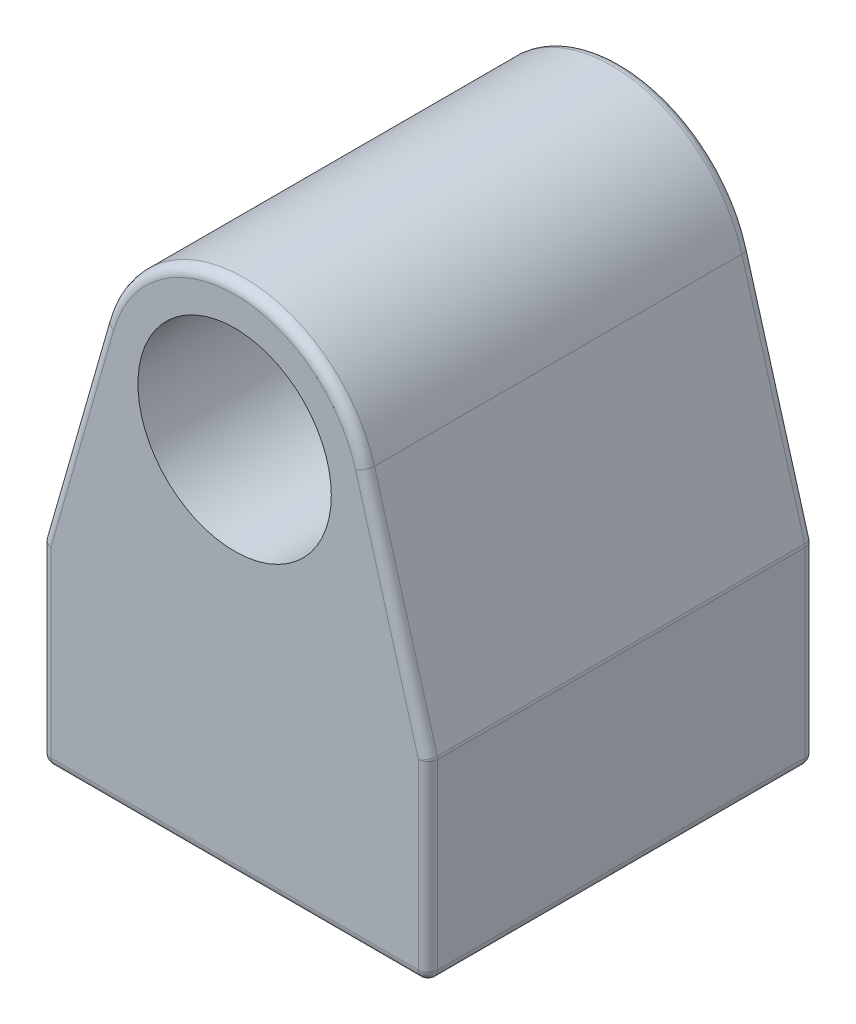
from build123d import *

# Parameters (mm, degrees)
SKETCH_1_R      = 5
EXTRUDE_1_DEPTH = 20
FILLET_1_R      = 0.5


with BuildPart() as part:
    # 草图1 → 凸台-拉伸1 (new body)
    with BuildSketch(Plane.XY):
        with BuildLine():
            Line((6.729794889, 16.426099883), (10, 5))
            Line((10, 5), (10, -5))
            Line((10, -5), (-10, -5))
            Line((-10, -5), (-10, 5))
            Line((-10, 5), (-6.729794889, 16.426099883))
            ThreePointArc((-6.729794889, 16.426099883), (0, 21.5), (6.729794889, 16.426099883))
        make_face()
        with Locations((0, 14.5)):
            Circle(SKETCH_1_R, mode=Mode.SUBTRACT)
    extrude(amount=EXTRUDE_1_DEPTH)

    # 圆角1
    fillet_1_edges = [part.edges().sort_by_distance(p)[0] for p in [
        (10, -5, 10),
        (-10, -5, 10),
        (-10, 5, 10),
        (10, 5, 10),
        (0, 21.5, 20),
        (-8.364897444, 10.713049941, 20),
        (-10, 0, 20),
        (0, -5, 20),
        (10, 0, 20),
        (0, -5, 0),
        (-10, 0, 0),
        (-8.364897444, 10.713049941, 0),
        (0, 21.5, 0),
        (8.364897444, 10.713049941, 0),
        (10, 0, 0),
        (8.364897444, 10.713049941, 20),
    ]]
    fillet(fillet_1_edges, radius=FILLET_1_R)


solid = part.part
